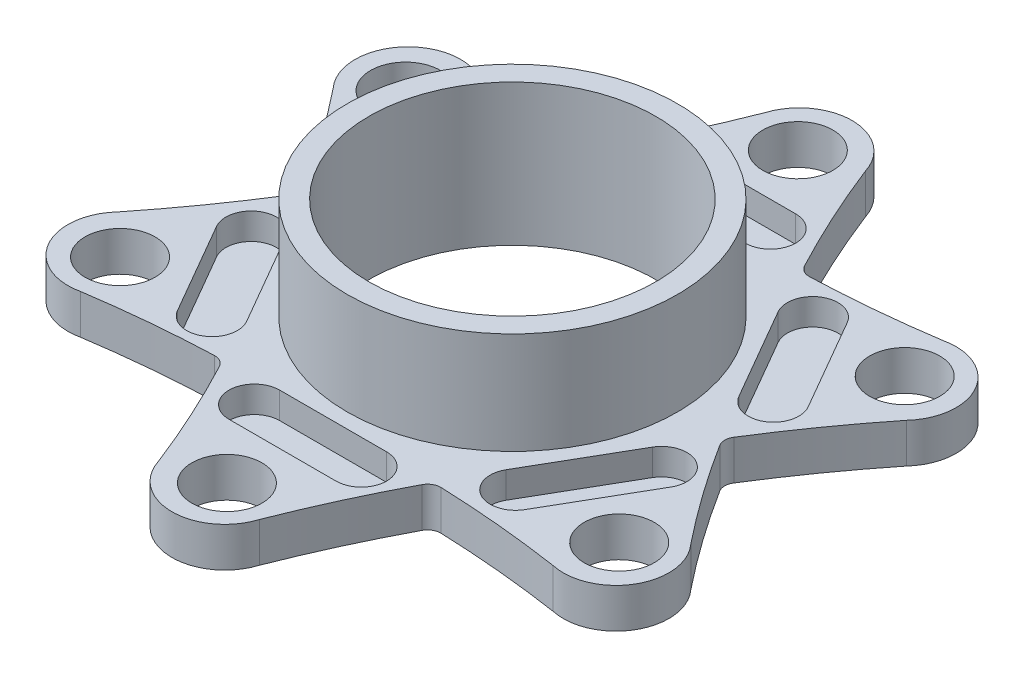
from build123d import *

# Parameters (mm, degrees)
SKETCH1_R                 = 31.75
CENTERCIRCLEEXTRUDE_DEPTH = 19.558
SKETCH2_R                 = 80.01
BASEEXPAND_DEPTH          = 7.62
SKETCH3_R                 = 27.559
CENTERCUT_DEPTH           = 27.178
SKETCH4_R                 = 6.731
OUTERCIRCLECUT_DEPTH      = 7.62
SKETCH8_R                 = 80.01
STARFISHCUT_DEPTH         = 7.62
BATMAN_CUT_DEPTH          = 5.08
FILLET1_R                 = 2.54


with BuildPart() as part:
    # Sketch1 → CenterCircleExtrude (new body)
    with BuildSketch(Plane(origin=(0, 0, 0), x_dir=(1, 0, 0), z_dir=(0, 1, 0))):
        Circle(SKETCH1_R)
    extrude(amount=CENTERCIRCLEEXTRUDE_DEPTH)

    # Sketch2 → BaseExpand (add)
    with BuildSketch(Plane.XZ):
        Circle(SKETCH2_R)
    extrude(amount=BASEEXPAND_DEPTH)

    # Sketch3 → CenterCut (cut)
    with BuildSketch(Plane(origin=(0, 19.558, 0), x_dir=(1, 0, 0), z_dir=(0, 1, 0))):
        Circle(SKETCH3_R)
    extrude(amount=-CENTERCUT_DEPTH, mode=Mode.SUBTRACT)

    # Sketch4 → OuterCircleCut (cut)
    with BuildSketch(Plane(origin=(0, 0, 0), x_dir=(1, 0, 0), z_dir=(0, 1, 0))):
        with Locations((-0.261130397, 55.117381423)):
            Circle(SKETCH4_R)
        with Locations((47.602487304, 27.784836269)):
            Circle(SKETCH4_R)
        with Locations((47.863617701, -27.332545154)):
            Circle(SKETCH4_R)
        with Locations((0.261130397, -55.117381423)):
            Circle(SKETCH4_R)
        with Locations((-47.602487304, -27.784836269)):
            Circle(SKETCH4_R)
        with Locations((-47.863617701, 27.332545154)):
            Circle(SKETCH4_R)
    extrude(amount=-OUTERCIRCLECUT_DEPTH, mode=Mode.SUBTRACT)

    # Sketch8 → StarfishCut (cut)
    with BuildSketch(Plane(origin=(0, 0, 0), x_dir=(1, 0, 0), z_dir=(0, 1, 0))):
        Circle(SKETCH8_R)
        with BuildLine():
            ThreePointArc((-9.691634922, 58.167231466), (0, 65.278), (9.691634922, 58.167231466))
            ThreePointArc((9.691634922, 58.167231466), (14.680421474, 46.487646722), (20.366200635, 35.131036031))
            ThreePointArc((20.366200635, 35.131036031), (32.932591729, 35.888695551), (45.430991402, 37.398079103))
            ThreePointArc((45.430991402, 37.398079103), (46.084351809, 37.521062437), (46.744356679, 37.60105177))
            ThreePointArc((46.744356679, 37.60105177), (54.497784748, 34.973113956), (57.796096952, 27.480261323))
            ThreePointArc((57.796096952, 27.480261323), (57.324919213, 24.422104494), (55.95508845, 21.647596369))
            ThreePointArc((55.95508845, 21.647596369), (55.55581322, 21.116010052), (55.122626325, 20.611675009))
            ThreePointArc((55.122626325, 20.611675009), (47.502202506, 10.451466749), (40.509978727, -0.15086779))
            ThreePointArc((40.509978727, -0.15086779), (47.449326667, -10.654851952), (55.005691003, -20.7240918))
            ThreePointArc((55.005691003, -20.7240918), (55.438877898, -21.228426843), (55.838153128, -21.76001316))
            ThreePointArc((55.838153128, -21.76001316), (57.207983891, -24.534521285), (57.67916163, -27.592678114))
            ThreePointArc((57.67916163, -27.592678114), (54.380849426, -35.085530747), (46.627421357, -37.713468561))
            ThreePointArc((46.627421357, -37.713468561), (45.967416487, -37.633479228), (45.31405608, -37.510495894))
            ThreePointArc((45.31405608, -37.510495894), (32.70484571, -35.991119409), (20.026842771, -35.236843257))
            ThreePointArc((20.026842771, -35.236843257), (14.399799615, -46.498486939), (9.457764278, -58.077110338))
            ThreePointArc((9.457764278, -58.077110338), (9.237590766, -58.704428716), (8.976861126, -59.316004366))
            ThreePointArc((8.976861126, -59.316004366), (-0.233870644, -65.187878872), (-9.444602414, -59.316004366))
            ThreePointArc((-9.444602414, -59.316004366), (-9.705332054, -58.704428716), (-9.925505566, -58.077110338))
            ThreePointArc((-9.925505566, -58.077110338), (-14.914292118, -46.397525594), (-20.600071279, -35.040914903))
            ThreePointArc((-20.600071279, -35.040914903), (-33.166462373, -35.798574423), (-45.664862046, -37.307957975))
            ThreePointArc((-45.664862046, -37.307957975), (-46.318222453, -37.430941309), (-46.978227323, -37.510930642))
            ThreePointArc((-46.978227323, -37.510930642), (-56.668785698, -32.470140195), (-56.188959094, -21.557475241))
            ThreePointArc((-56.188959094, -21.557475241), (-55.789683864, -21.025888924), (-55.356496969, -20.521553881))
            ThreePointArc((-55.356496969, -20.521553881), (-47.73607315, -10.361345621), (-40.743849371, 0.240988918))
            ThreePointArc((-40.743849371, 0.240988918), (-47.683197311, 10.74497308), (-55.239561647, 20.814212928))
            ThreePointArc((-55.239561647, 20.814212928), (-55.672748542, 21.318547971), (-56.072023772, 21.850134288))
            ThreePointArc((-56.072023772, 21.850134288), (-56.551850376, 32.762799241), (-46.861292001, 37.803589689))
            ThreePointArc((-46.861292001, 37.803589689), (-46.201287131, 37.723600356), (-45.547926724, 37.600617021))
            ThreePointArc((-45.547926724, 37.600617021), (-32.938716354, 36.081240537), (-20.260713415, 35.326964385))
            ThreePointArc((-20.260713415, 35.326964385), (-14.633670259, 46.588608067), (-9.691634922, 58.167231466))
        make_face(mode=Mode.SUBTRACT)
    extrude(amount=-STARFISHCUT_DEPTH, mode=Mode.SUBTRACT)

    # Sketch14 → Batman Cut (cut)
    with BuildSketch(Plane(origin=(0, 0, 0), x_dir=(1, 0, 0), z_dir=(0, 1, 0))):
        with BuildLine():
            Line((35.018559386, 8.520826348), (24.742614343, 26.319285257))
            ThreePointArc((24.742614343, 26.319285257), (26.523552445, 32.965836738), (33.170103927, 31.184898636))
            Line((33.170103927, 31.184898636), (43.446048969, 13.386439727))
            ThreePointArc((43.446048969, 13.386439727), (41.665110867, 6.739888246), (35.018559386, 8.520826348))
        make_face()
        with BuildLine():
            Line((24.888531771, -26.066548858), (35.164476813, -8.268089949))
            ThreePointArc((35.164476813, -8.268089949), (41.811028295, -6.487151847), (43.591966397, -13.133703329))
            Line((43.591966397, -13.133703329), (33.316021354, -30.932162238))
            ThreePointArc((33.316021354, -30.932162238), (26.669469873, -32.71310034), (24.888531771, -26.066548858))
        make_face()
        with BuildLine():
            Line((-10.130027615, -34.587375206), (10.42186247, -34.587375206))
            ThreePointArc((10.42186247, -34.587375206), (15.28747585, -39.452988585), (10.42186247, -44.318601965))
            Line((10.42186247, -44.318601965), (-10.130027615, -44.318601965))
            ThreePointArc((-10.130027615, -44.318601965), (-14.995640994, -39.452988585), (-10.130027615, -34.587375206))
        make_face()
        with BuildLine():
            Line((10.130027615, 34.587375206), (-10.42186247, 34.587375206))
            ThreePointArc((-10.42186247, 34.587375206), (-15.28747585, 39.452988585), (-10.42186247, 44.318601965))
            Line((-10.42186247, 44.318601965), (10.130027615, 44.318601965))
            ThreePointArc((10.130027615, 44.318601965), (14.995640994, 39.452988585), (10.130027615, 34.587375206))
        make_face()
        with BuildLine():
            Line((-35.018559386, -8.520826348), (-24.742614343, -26.319285257))
            ThreePointArc((-24.742614343, -26.319285257), (-26.523552445, -32.965836738), (-33.170103927, -31.184898636))
            Line((-33.170103927, -31.184898636), (-43.446048969, -13.386439727))
            ThreePointArc((-43.446048969, -13.386439727), (-41.665110867, -6.739888246), (-35.018559386, -8.520826348))
        make_face()
        with BuildLine():
            Line((-24.888531771, 26.066548858), (-35.164476813, 8.268089949))
            ThreePointArc((-35.164476813, 8.268089949), (-41.811028295, 6.487151847), (-43.591966397, 13.133703329))
            Line((-43.591966397, 13.133703329), (-33.316021354, 30.932162238))
            ThreePointArc((-33.316021354, 30.932162238), (-26.669469873, 32.71310034), (-24.888531771, 26.066548858))
        make_face()
    extrude(amount=-BATMAN_CUT_DEPTH, mode=Mode.SUBTRACT)

    # Fillet1
    fillet1_edges = [part.edges().sort_by_distance(p)[0] for p in [
        (20.366200635, -3.81, -35.131036031),
        (-20.260713415, -3.81, -35.326964385),
        (-40.743849371, -3.81, -0.240988918),
        (-20.600071279, -3.81, 35.040914903),
        (20.026842771, -3.81, 35.236843257),
        (40.509978727, -3.81, 0.15086779),
    ]]
    fillet(fillet1_edges, radius=FILLET1_R)


solid = part.part
